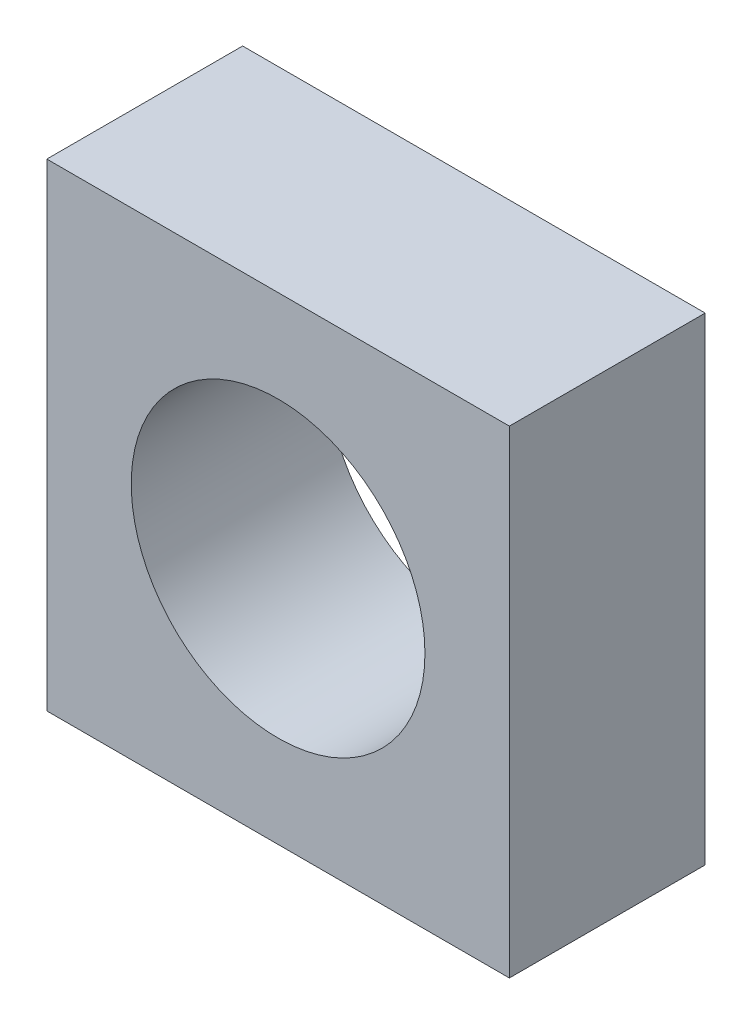
from build123d import *

# Parameters (mm, degrees)
CROQUIS1_W              = 60
CROQUIS1_H              = 62
CROQUIS1_R              = 19.05
SALIENTE_EXTRUIR1_DEPTH = 25.4


with BuildPart() as part:
    # Croquis1 → Saliente-Extruir1 (new body)
    with BuildSketch(Plane.XY):
        Rectangle(CROQUIS1_W, CROQUIS1_H)
        Circle(CROQUIS1_R, mode=Mode.SUBTRACT)
    extrude(amount=SALIENTE_EXTRUIR1_DEPTH)


solid = part.part
